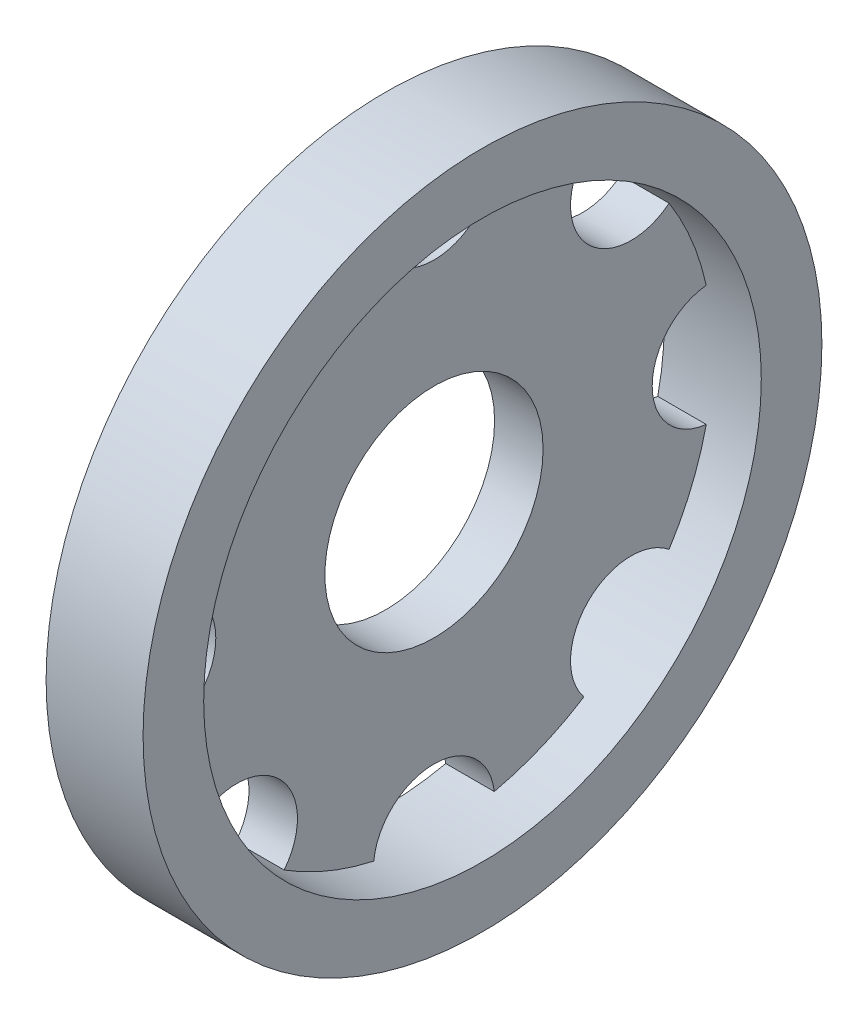
from build123d import *

# Parameters (mm, degrees)
ESBO_O1_R                = 4.5
RESSALTO_EXTRUS_O1_DEPTH = 2
ESBO_O2_R                = 14
ESBO_O2_R_2              = 11.5
RESSALTO_EXTRUS_O2_DEPTH = 2


with BuildPart() as part:
    # Esboço1 → Ressalto-extrusão1 (new body)
    with BuildSketch(Plane(origin=(0, 0, 0), x_dir=(0, 0, -1), z_dir=(1, 0, 0))):
        with BuildLine():
            ThreePointArc((11.22826087, -2.485187688), (9, 0), (11.22826087, 2.485187688))
            ThreePointArc((11.22826087, 2.485187688), (10.624614624, 4.400859472), (9.696872469, 6.182286335))
            ThreePointArc((9.696872469, 6.182286335), (6.363961031, 6.363961031), (6.182286335, 9.696872469))
            ThreePointArc((6.182286335, 9.696872469), (4.400859472, 10.624614624), (2.485187688, 11.22826087))
            ThreePointArc((2.485187688, 11.22826087), (0, 9), (-2.485187688, 11.22826087))
            ThreePointArc((-2.485187688, 11.22826087), (-4.400859472, 10.624614624), (-6.182286335, 9.696872469))
            ThreePointArc((-6.182286335, 9.696872469), (-5.773380668, 8.961304948), (-5.631727984, 8.131727984))
            ThreePointArc((-5.631727984, 8.131727984), (-7.050724101, 5.877525108), (-9.696872469, 6.182286335))
            ThreePointArc((-9.696872469, 6.182286335), (-10.624614624, 4.400859472), (-11.22826087, 2.485187688))
            ThreePointArc((-11.22826087, 2.485187688), (-9.638636545, 1.668929623), (-9, 0))
            ThreePointArc((-9, 0), (-9.638636545, -1.668929623), (-11.22826087, -2.485187688))
            ThreePointArc((-11.22826087, -2.485187688), (-10.624614624, -4.400859472), (-9.696872469, -6.182286335))
            ThreePointArc((-9.696872469, -6.182286335), (-7.050724101, -5.877525108), (-5.631727984, -8.131727984))
            ThreePointArc((-5.631727984, -8.131727984), (-5.773380668, -8.961304948), (-6.182286335, -9.696872469))
            ThreePointArc((-6.182286335, -9.696872469), (-4.400859472, -10.624614624), (-2.485187688, -11.22826087))
            ThreePointArc((-2.485187688, -11.22826087), (0, -9), (2.485187688, -11.22826087))
            ThreePointArc((2.485187688, -11.22826087), (4.400859472, -10.624614624), (6.182286335, -9.696872469))
            ThreePointArc((6.182286335, -9.696872469), (6.363961031, -6.363961031), (9.696872469, -6.182286335))
            ThreePointArc((9.696872469, -6.182286335), (10.624614624, -4.400859472), (11.22826087, -2.485187688))
        make_face()
        Circle(ESBO_O1_R, mode=Mode.SUBTRACT)
    extrude(amount=RESSALTO_EXTRUS_O1_DEPTH)

    # Esboço2 → Ressalto-extrusão2 (add, symmetric)
    with BuildSketch(Plane(origin=(2, 0, 0), x_dir=(0, 0, -1), z_dir=(1, 0, 0))):
        Circle(ESBO_O2_R)
        with Locations(Location((0, 0, 0), (0, 0, 167.519737803))):
            Circle(ESBO_O2_R_2, mode=Mode.SUBTRACT)
    extrude(amount=RESSALTO_EXTRUS_O2_DEPTH, both=True)


solid = part.part
